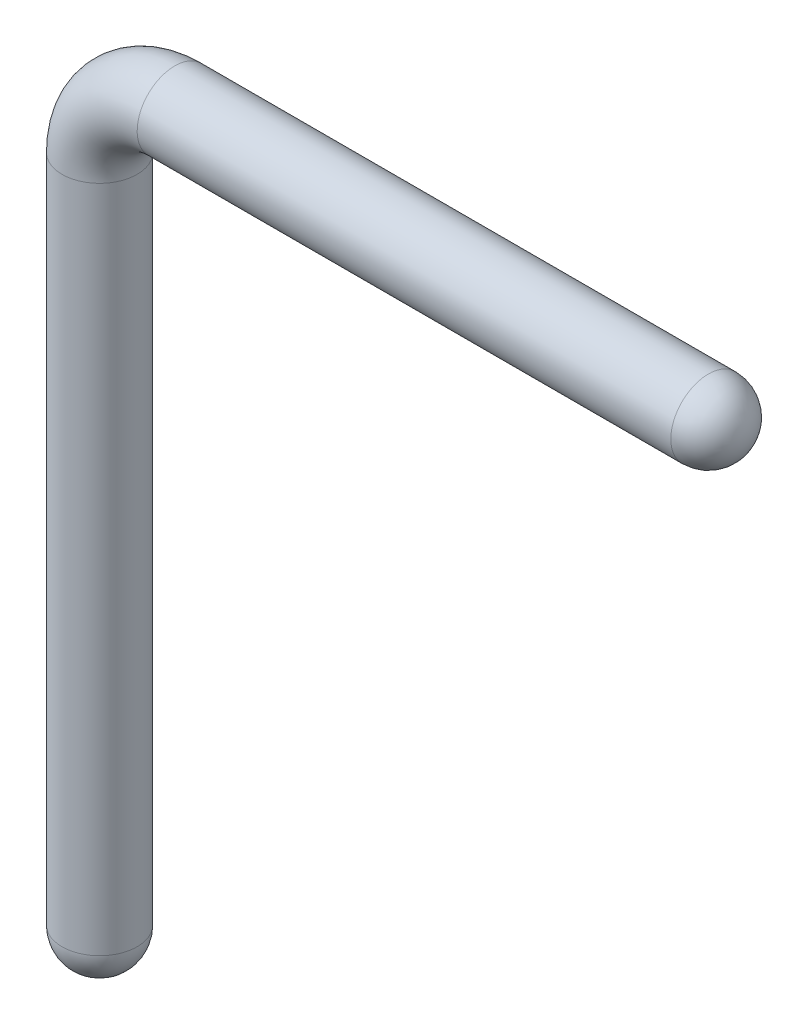
from build123d import *

# Parameters (mm, degrees)
SKETCH_2_R = 0.25
FILLET_1_R = 0.25


with BuildPart() as part:
    # 스윕3: sweep along a path in 스케치1
    with BuildLine(Plane.XY) as sweep_3_path:
        Line((0, 0), (0, 4.7))
        ThreePointArc((0, 4.7), (0.146446609, 5.053553391), (0.5, 5.2))
        Line((0.5, 5.2), (4.3, 5.2))
    # 스케치2 → 스윕3 (sweep)
    with BuildSketch(Plane(origin=(0, 0, 0), x_dir=(1, 0, 0), z_dir=(0, 1, 0))):
        Circle(SKETCH_2_R)
    sweep(path=sweep_3_path.line)

    # 필렛1
    fillet_1_edges = [part.edges().sort_by_distance(p)[0] for p in [
        (4.3, 5.45, 0),
        (-0.25, 0, 0),
    ]]
    fillet(fillet_1_edges, radius=FILLET_1_R)


solid = part.part
